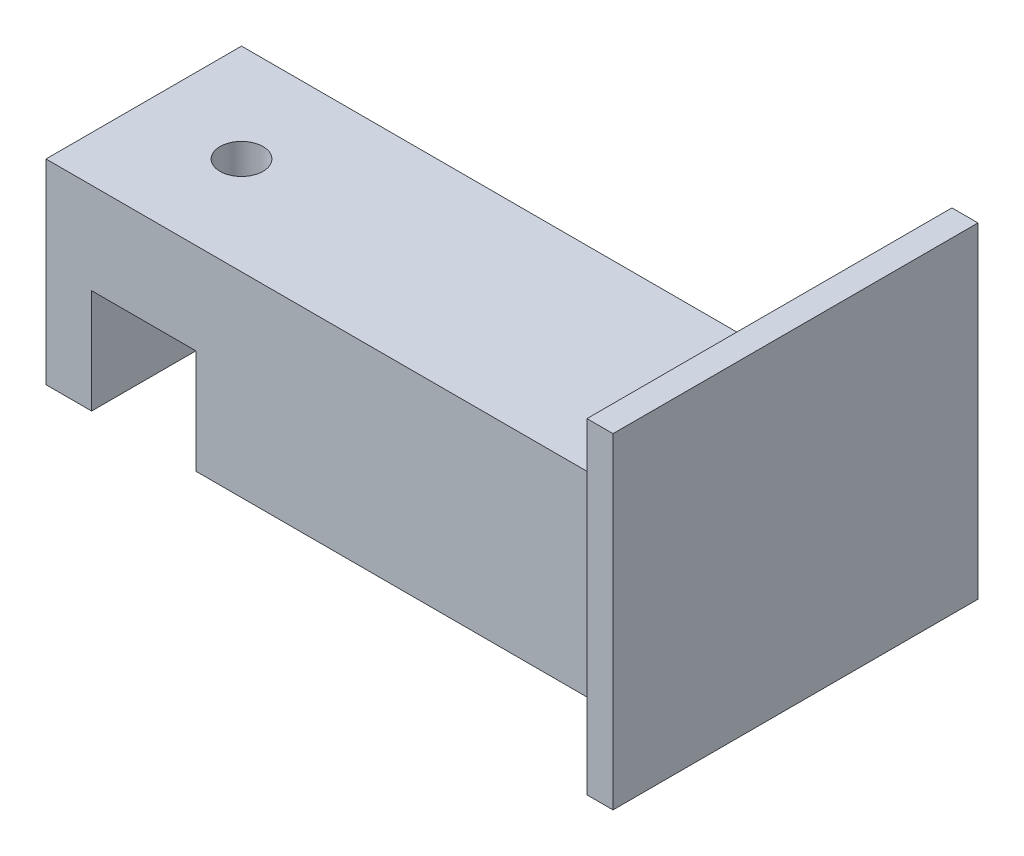
from build123d import *

# Parameters (mm, degrees)
SKETCH_1_W          = 15
SKETCH_1_H          = 15
EXTRUDE_1_DEPTH     = 15
SKETCH_2_W          = 8
SKETCH_2_H          = 8
CUT_EXTRUDE_1_DEPTH = 17.5
SKETCH_3_R          = 1.65
CUT_EXTRUDE_2_DEPTH = 17.5
SKETCH_5_W          = 15
SKETCH_5_H          = 15
EXTRUDE_2_DEPTH     = 35
SKETCH_6_W          = 28
SKETCH_6_H          = 25
EXTRUDE_3_DEPTH     = 2


with BuildPart() as part:
    # 草图1 → 凸台-拉伸1 (new body)
    with BuildSketch(Plane(origin=(0, 0, 0), x_dir=(1, 0, 0), z_dir=(0, 1, 0))):
        Rectangle(SKETCH_1_W, SKETCH_1_H)
    extrude(amount=-EXTRUDE_1_DEPTH)

    # 草图2 → 切除-拉伸1 (cut, symmetric)
    with BuildSketch(Plane.XY):
        with Locations((0, -11)):
            Rectangle(SKETCH_2_W, SKETCH_2_H)
    extrude(amount=CUT_EXTRUDE_1_DEPTH, both=True, mode=Mode.SUBTRACT)

    # 草图3 → 切除-拉伸2 (cut, symmetric)
    with BuildSketch(Plane(origin=(0, 0, 0), x_dir=(1, 0, 0), z_dir=(0, 1, 0))):
        with Locations(Location((0, 0, 0), (0, 0, 270))):
            Circle(SKETCH_3_R)
    extrude(amount=CUT_EXTRUDE_2_DEPTH, both=True, mode=Mode.SUBTRACT)

    # 草图5 → 凸台-拉伸2 (add)
    with BuildSketch(Plane(origin=(7.5, 0, 0), x_dir=(0, 0, -1), z_dir=(1, 0, 0))):
        with Locations((0, -7.5)):
            Rectangle(SKETCH_5_W, SKETCH_5_H)
    extrude(amount=EXTRUDE_2_DEPTH)

    # 草图6 → 凸台-拉伸3 (add)
    with BuildSketch(Plane(origin=(42.5, 0, 0), x_dir=(0, 0, -1), z_dir=(1, 0, 0))):
        with Locations((0, -2.5)):
            Rectangle(SKETCH_6_W, SKETCH_6_H)
    extrude(amount=-EXTRUDE_3_DEPTH)


solid = part.part
